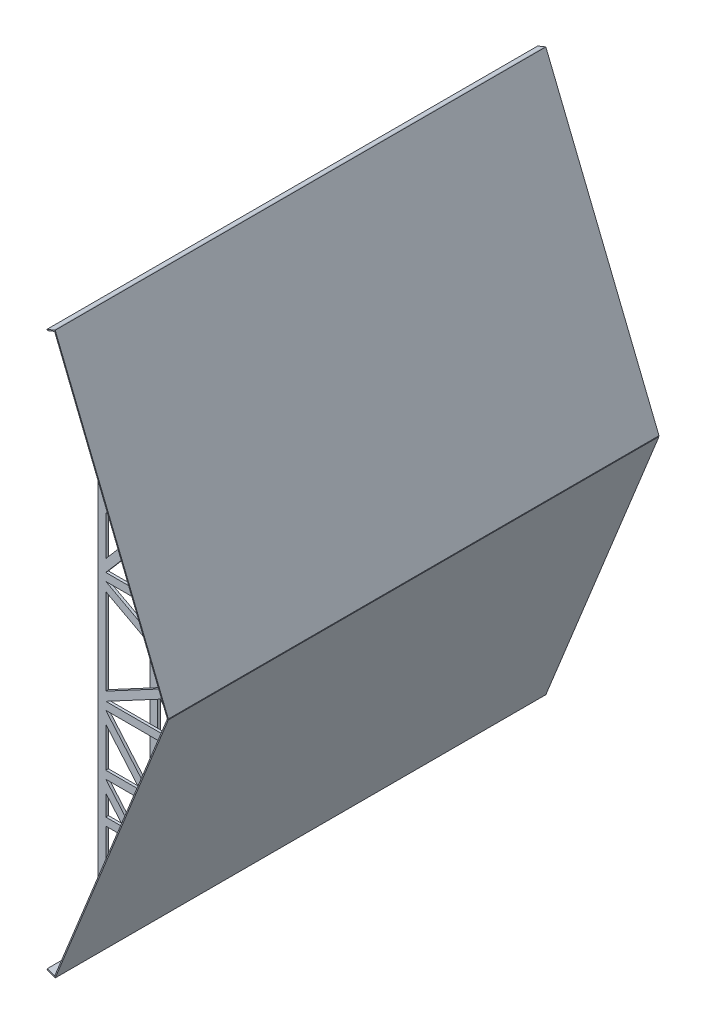
from build123d import *

# Parameters (mm, degrees)
EXTRUDE_1_DEPTH        = 50
PATTERN_LINEAR_1_COUNT = 9
PATTERN_LINEAR_1_PITCH = 1000.25
SKETCH_4_W             = 9452
SKETCH_4_H             = 5819.851885864
EXTRUDE_2_DEPTH        = 20
SKETCH_5_W             = 150
SKETCH_5_H             = 9452
EXTRUDE_3_DEPTH        = 20


with BuildPart() as part:
    # Эскиз1 → Бобышка-Вытянуть1 (new body)
    with BuildSketch(Plane.XY):
        Polygon((200, -50), (200, -9327.909063353), (-82.818358085, -10027.909063353), (56.2592201, -10084.100052365), (2236.039502656, -4688.954531676), (56.2592201, 706.190989012), (-82.818358085, 650), align=None)
        Polygon((350, -8956.64603534), (350, -7770.091865614), (829.399002943, -7770.091865614), align=None, mode=Mode.SUBTRACT)
        Polygon((350, -5688.954531676), (1670.233065419, -5688.954531676), (2033.856668671, -4788.954531676), align=None, mode=Mode.SUBTRACT)
        Polygon((350, -5838.954531676), (1609.629131544, -5838.954531676), (1205.602905708, -6838.954531676), align=None, mode=Mode.SUBTRACT)
        Polygon((350, -6069.682379215), (1008.191488927, -6838.954531676), (350, -6838.954531676), align=None, mode=Mode.SUBTRACT)
        Polygon((350, -5518.873006816), (350, -3859.036056536), (1902.737509797, -4688.954531676), align=None, mode=Mode.SUBTRACT)
        Polygon((350, -6988.954531676), (1144.998971833, -6988.954531676), (890.002936819, -7620.091865614), align=None, mode=Mode.SUBTRACT)
        Polygon((350, -7219.682379215), (692.591520037, -7620.091865614), (350, -7620.091865614), align=None, mode=Mode.SUBTRACT)
        Polygon((350, -1607.817197738), (829.399002943, -1607.817197738), (350, -421.263028012), align=None, mode=Mode.SUBTRACT)
        Polygon((350, -2158.226684138), (692.591520037, -1757.817197738), (350, -1757.817197738), align=None, mode=Mode.SUBTRACT)
        Polygon((350, -2388.954531676), (890.002936819, -1757.817197738), (1144.998971833, -2388.954531676), align=None, mode=Mode.SUBTRACT)
        Polygon((350, -2538.954531676), (350, -3308.226684138), (1008.191488927, -2538.954531676), align=None, mode=Mode.SUBTRACT)
        Polygon((350, -3538.954531676), (1609.629131544, -3538.954531676), (1205.602905708, -2538.954531676), align=None, mode=Mode.SUBTRACT)
        Polygon((1670.233065419, -3688.954531676), (2033.856668671, -4588.954531676), (350, -3688.954531676), align=None, mode=Mode.SUBTRACT)
    extrude(amount=-EXTRUDE_1_DEPTH)


with BuildPart() as pattern_linear_1_1:
    # Линейный массив1: pattern copy
    add(part.part.moved(Location(Vector(0, 0, -1) * (1 * PATTERN_LINEAR_1_PITCH))))


with BuildPart() as pattern_linear_1_2:
    # Линейный массив1: pattern copy
    add(part.part.moved(Location(Vector(0, 0, -1) * (2 * PATTERN_LINEAR_1_PITCH))))


with BuildPart() as pattern_linear_1_3:
    # Линейный массив1: pattern copy
    add(part.part.moved(Location(Vector(0, 0, -1) * (3 * PATTERN_LINEAR_1_PITCH))))


with BuildPart() as pattern_linear_1_4:
    # Линейный массив1: pattern copy
    add(part.part.moved(Location(Vector(0, 0, -1) * (4 * PATTERN_LINEAR_1_PITCH))))


with BuildPart() as pattern_linear_1_5:
    # Линейный массив1: pattern copy
    add(part.part.moved(Location(Vector(0, 0, -1) * (5 * PATTERN_LINEAR_1_PITCH))))


with BuildPart() as pattern_linear_1_6:
    # Линейный массив1: pattern copy
    add(part.part.moved(Location(Vector(0, 0, -1) * (6 * PATTERN_LINEAR_1_PITCH))))


with BuildPart() as pattern_linear_1_7:
    # Линейный массив1: pattern copy
    add(part.part.moved(Location(Vector(0, 0, -1) * (7 * PATTERN_LINEAR_1_PITCH))))


with BuildPart() as pattern_linear_1_8:
    # Линейный массив1: pattern copy
    add(part.part.moved(Location(Vector(0, 0, -1) * (8 * PATTERN_LINEAR_1_PITCH))))


with BuildPart() as body_10:
    # Эскиз4 → Бобышка-Вытянуть2 (new body)
    with BuildSketch(Plane(origin=(3550.866613088, -1434.64323613, 0), x_dir=(0, 0, -1), z_dir=(0.9271838545667894, -0.3746065934159071, 0))):
        with Locations((4026, -6419.813738667)):
            Rectangle(SKETCH_4_W, SKETCH_4_H)
    extrude(amount=EXTRUDE_2_DEPTH)


with BuildPart() as body_11:
    # Эскиз5 → Бобышка-Вытянуть3 (new body)
    with BuildSketch(Plane(origin=(-3494.981999581, -8650.38400009, 0), x_dir=(0.9271838545667894, -0.3746065934159071, 0), z_dir=(-0.3746065934159071, -0.9271838545667894, 0))):
        with Locations((3754.733008829, -4026)):
            Rectangle(SKETCH_5_W, SKETCH_5_H)
    extrude(amount=-EXTRUDE_3_DEPTH)


with BuildPart() as body_12:
    # Зеркальное отражение2: mirrored copy
    add(body_10.part.mirror(Plane.ZX.offset(-4688.954531676)))


with BuildPart() as body_13:
    # Mirror 2 2: mirrored copy
    add(body_11.part.mirror(Plane.ZX.offset(-4688.954531676)))


solid = Compound([part.part, pattern_linear_1_1.part, pattern_linear_1_2.part, pattern_linear_1_3.part, pattern_linear_1_4.part, pattern_linear_1_5.part, pattern_linear_1_6.part, pattern_linear_1_7.part, pattern_linear_1_8.part, body_10.part, body_11.part, body_12.part, body_13.part])
